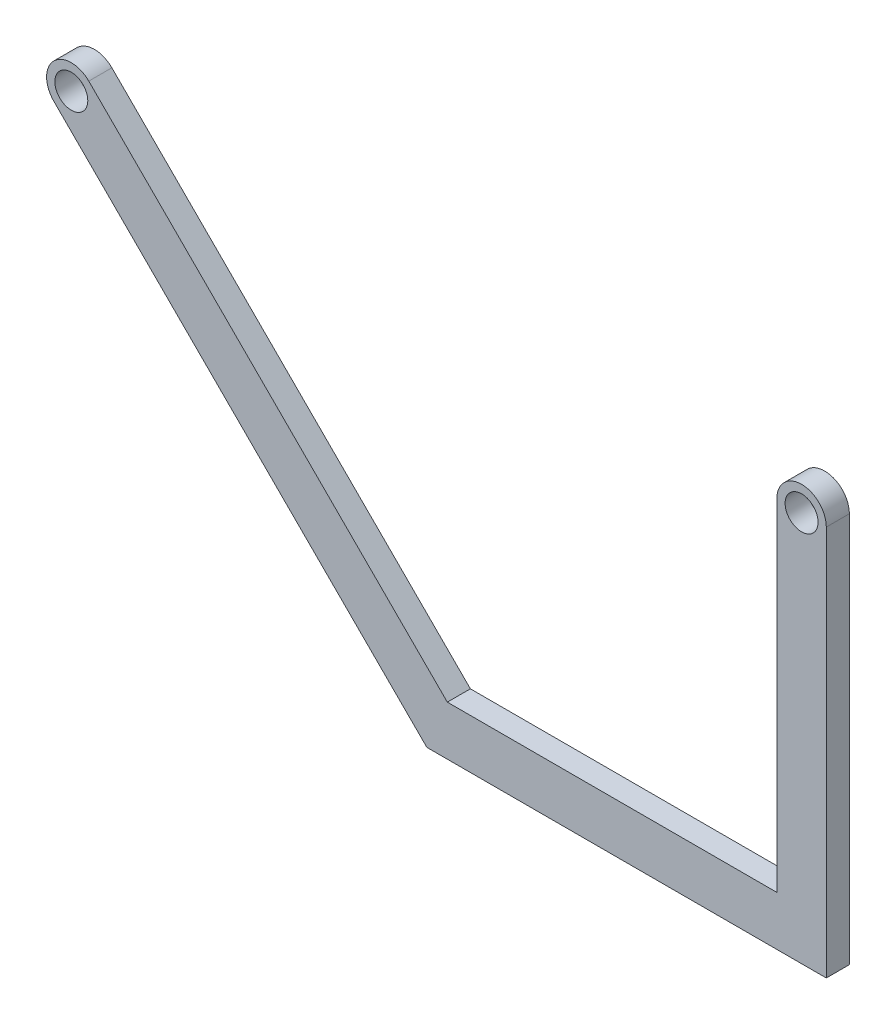
from build123d import *

# Parameters (mm, degrees)
BOSS_EXTRUDE1_DEPTH        = 3.556
BOSS_EXTRUDE1_DEPTH_BACK   = 3.556
F_3_4_0_4_DIAMETER_HOLE1_D = 10.16


with BuildPart() as part:
    # Sketch1 → Boss-Extrude1 (new, two sides: drawn at the far end of the back side and taken through both)
    with BuildSketch(Plane.XY.offset(-BOSS_EXTRUDE1_DEPTH_BACK)):
        with BuildLine():
            Line((46.336307345, 120.396), (46.336307345, 15.24))
            Line((46.336307345, 15.24), (-55.263692655, 15.24))
            Line((-55.263692655, 15.24), (-165.807846327, 125.784153673))
            ThreePointArc((-165.807846327, 125.784153673), (-176.584153673, 125.784153673), (-176.584153673, 115.007846327))
            Line((-176.584153673, 115.007846327), (-61.576307345, 0))
            Line((-61.576307345, 0), (61.576307345, 0))
            Line((61.576307345, 0), (61.576307345, 120.396))
            ThreePointArc((61.576307345, 120.396), (53.956307345, 128.016), (46.336307345, 120.396))
        make_face()
    extrude(amount=BOSS_EXTRUDE1_DEPTH + BOSS_EXTRUDE1_DEPTH_BACK)

    # 3/4 (0.4) Diameter Hole1 (through all)
    with Locations(Plane.XY.offset(3.556)):
        with Locations((-171.196, 120.396), (53.956307345, 120.396)):
            Hole(F_3_4_0_4_DIAMETER_HOLE1_D / 2)


solid = part.part
